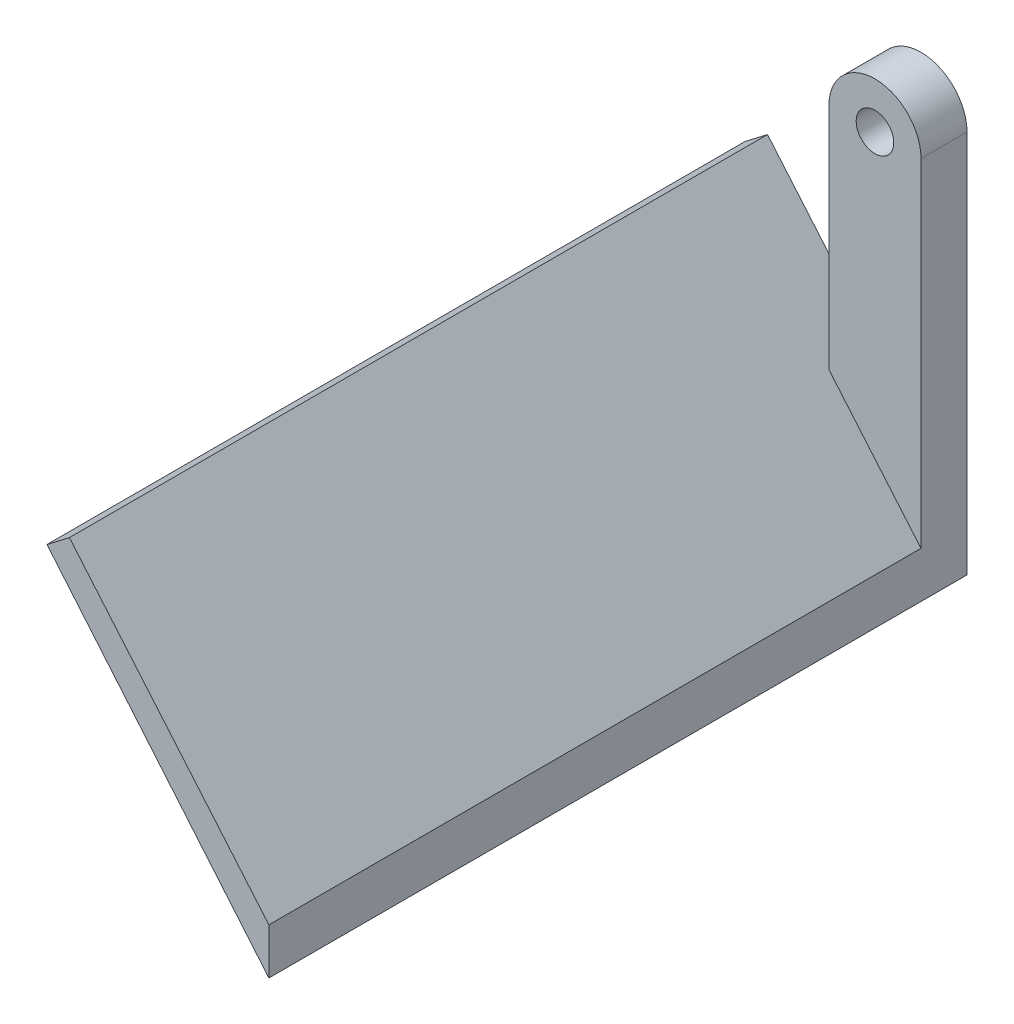
from build123d import *

# Parameters (mm, degrees)
CROQUIS2_R              = 2.45
SALIENTE_EXTRUIR1_DEPTH = 6
SALIENTE_EXTRUIR2_DEPTH = 91
CORTAR_EXTRUIR1_DEPTH   = 91


with BuildPart() as part:
    # Croquis2 → Saliente-Extruir1 (new body)
    with BuildSketch(Plane(origin=(0, 0, -2903.883018812), x_dir=(-1, 0, 0), z_dir=(0, 0, -1))):
        with BuildLine():
            Line((-11.1, 0), (-11.1, -50))
            Line((-11.1, -50), (0.9, -50))
            Line((0.9, -50), (0.9, 0))
            ThreePointArc((0.9, 0), (-5.1, 6), (-11.1, 0))
        make_face()
        with Locations((-5.1, 0)):
            Circle(CROQUIS2_R, mode=Mode.SUBTRACT)
    extrude(amount=SALIENTE_EXTRUIR1_DEPTH)

    # Croquis3 → Saliente-Extruir2 (add)
    with BuildSketch(Plane(origin=(0, 0, -2909.883018812), x_dir=(-1, 0, 0), z_dir=(0, 0, -1))):
        Polygon((-11.1, -50), (17.825442436, -15.52800006), (14.903598687, -13.287396749), (-11.1, -44), align=None)
    extrude(amount=-SALIENTE_EXTRUIR2_DEPTH)

    # Croquis4 → Cortar-Extruir1 (cut)
    with BuildSketch(Plane(origin=(0, 0, -2909.883018812), x_dir=(-1, 0, 0), z_dir=(0, 0, -1))):
        Polygon((0.9, -35.698956889), (-11.1, -50), (-9.748210825, -87.200753785), (4.844427823, -87.200753785), (-12.615201312, -51.805746607), align=None)
    extrude(amount=-CORTAR_EXTRUIR1_DEPTH, mode=Mode.SUBTRACT)


solid = part.part
